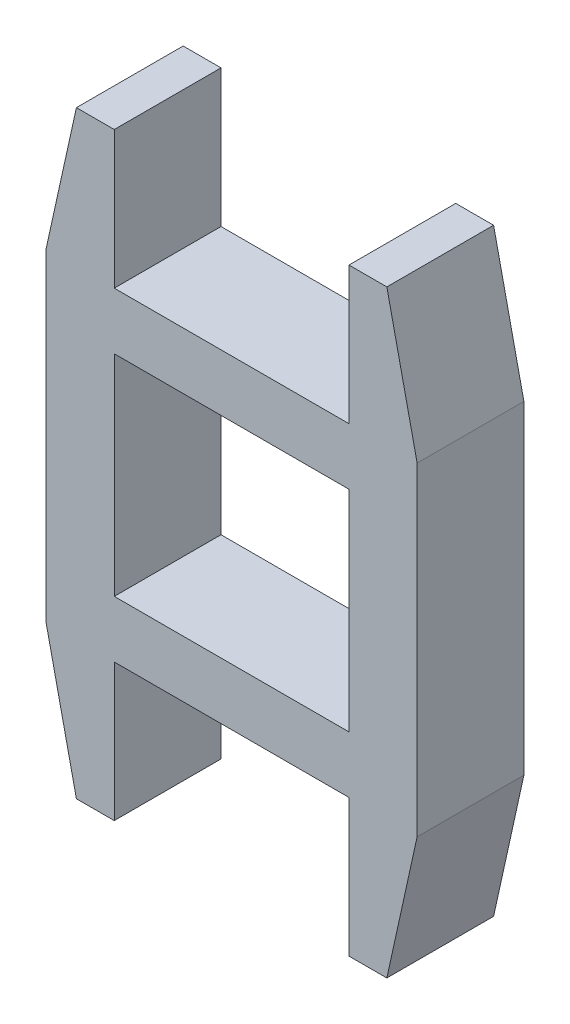
from build123d import *

# Parameters (mm, degrees)
SKETCH1_W           = 12.4
SKETCH1_H           = 11.1
BOSS_EXTRUDE1_DEPTH = 5.64


with BuildPart() as part:
    # Sketch1 → Boss-Extrude1 (new body)
    with BuildSketch(Plane.XY):
        Polygon((1245.209623553, 971.686361434), (1247.209623553, 971.686361434), (1247.209623553, 964.427195661), (1259.609623553, 964.427195661), (1259.609623553, 971.686361434), (1261.609623553, 971.686361434), (1263.209623553, 964.427195661), (1263.209623553, 947.327195661), (1261.609623553, 940.068029888), (1259.609623553, 940.068029888), (1259.609623553, 947.327195661), (1247.209623553, 947.327195661), (1247.209623553, 940.068029888), (1245.209623553, 940.068029888), (1243.609623553, 947.327195661), (1243.609623553, 964.427195661), align=None)
        with Locations((1253.409623553, 955.877195661)):
            Rectangle(SKETCH1_W, SKETCH1_H, mode=Mode.SUBTRACT)
    extrude(amount=BOSS_EXTRUDE1_DEPTH)


solid = part.part
